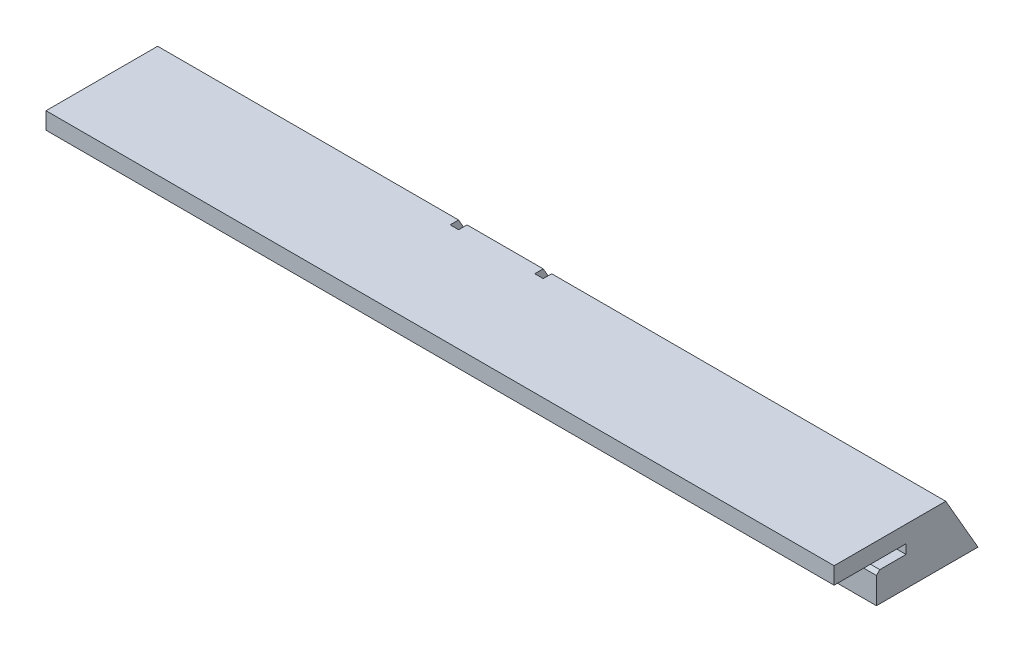
from build123d import *

# Parameters (mm, degrees)
SKETCH_2_W                  = 93.1
SKETCH_2_H                  = 10
EXTRUDE_1_DEPTH             = 3.5
SKETCH_4_W                  = 93.1
SKETCH_4_H                  = 6.5
EXTRUDE_2_DEPTH             = 1.1
SKETCH_5_W                  = 93.1
SKETCH_5_H                  = 10
EXTRUDE_3_DEPTH             = 2
CUT_EXTRUDE_1_DEPTH         = 94.867832616
SKETCH_7_W                  = 83.1
SKETCH_7_H                  = 1.1
EXTRUDE_4_DEPTH             = 3.5
CHAMFER_1_SIZE              = 0.4
CUT_EXTRUDE_2_REACH         = 95.868
SKETCH_8_R                  = 150
SKETCH_9_W                  = 93.1
SKETCH_9_H                  = 2
EXTRUDE_5_DEPTH             = 5
EXTRUDE_5_DIRECTION_2_REACH = 95.868
SKETCH_10_W                 = 93.1
SKETCH_10_H                 = 7.621023553
EXTRUDE_6_DEPTH             = 2
SKETCH_11_W                 = 1
SKETCH_11_H                 = 7.621023553
CUT_EXTRUDE_3_DEPTH         = 1


with BuildPart() as part:
    # 草图2 → 凸台-拉伸1 (new body)
    with BuildSketch(Plane(origin=(0, 0, 0), x_dir=(1, 0, 0), z_dir=(0, 1, 0))):
        with Locations((46.55, 5)):
            Rectangle(SKETCH_2_W, SKETCH_2_H)
    extrude(amount=EXTRUDE_1_DEPTH)

    # 草图4 → 凸台-拉伸2 (add)
    with BuildSketch(Plane(origin=(0, 3.5, 0), x_dir=(1, 0, 0), z_dir=(0, 1, 0))):
        with Locations((46.55, 6.75)):
            Rectangle(SKETCH_4_W, SKETCH_4_H)
    extrude(amount=EXTRUDE_2_DEPTH)

    # 草图5 → 凸台-拉伸3 (add)
    with BuildSketch(Plane(origin=(0, 4.6, 0), x_dir=(1, 0, 0), z_dir=(0, 1, 0))):
        with Locations((46.55, 5)):
            Rectangle(SKETCH_5_W, SKETCH_5_H)
    extrude(amount=EXTRUDE_3_DEPTH)

    # 草图6 → 切除-拉伸1 (cut, through all)
    with BuildSketch(Plane.ZY):
        Polygon((-10, 0), (-6.189488223, 6.6), (-10, 6.6), align=None)
    extrude(amount=-CUT_EXTRUDE_1_DEPTH, mode=Mode.SUBTRACT)

    # 草图7 → 凸台-拉伸4 (add)
    with BuildSketch(Plane.XY.offset(-3.5)):
        with Locations((46.55, 4.05)):
            Rectangle(SKETCH_7_W, SKETCH_7_H)
    extrude(amount=EXTRUDE_4_DEPTH)

    # 倒角1
    chamfer_1_edges = [part.edges().sort_by_distance(p)[0] for p in [
        (90.6, 3.5, 0),
        (2.5, 3.5, 0),
    ]]
    chamfer(chamfer_1_edges, length=CHAMFER_1_SIZE)

    # 草图8 → 切除-拉伸2 (cut, up to next)
    with BuildSketch(Plane.XZ, mode=Mode.PRIVATE) as cut_extrude_2_sk1:
        with Locations((46.55, 147)):
            Circle(SKETCH_8_R)
    cut_extrude_2_tool1 = extrude(cut_extrude_2_sk1.sketch, amount=-CUT_EXTRUDE_2_REACH, mode=Mode.PRIVATE) & part.part
    add(cut_extrude_2_tool1.solids().sort_by_distance((46.55, 0, 147))[0], mode=Mode.SUBTRACT)

    # 草图9 → 凸台-拉伸5 (add)
    with BuildSketch(Plane.XY):
        with Locations((46.55, 5.6)):
            Rectangle(SKETCH_9_W, SKETCH_9_H)
    extrude(amount=EXTRUDE_5_DEPTH)

    # 草图9 → 凸台-拉伸5 direction 2 (add, up to next)
    with BuildSketch(Plane.XY, mode=Mode.PRIVATE) as extrude_5_direction_2_sk1:
        with Locations((46.55, 5.6)):
            Rectangle(SKETCH_9_W, SKETCH_9_H)
    extrude_5_direction_2_tool1 = extrude(extrude_5_direction_2_sk1.sketch, amount=-EXTRUDE_5_DIRECTION_2_REACH, mode=Mode.PRIVATE) - part.part
    add(extrude_5_direction_2_tool1.solids().sort_by_distance((46.55, 5.6, 0))[0])

    # 草图10 → 凸台-拉伸6 (add, along a direction that is not the sketch's normal)
    with BuildSketch(Plane(origin=(0, 4.330127019, -7.5), x_dir=(-1, 0, 0), z_dir=(0, 0.4999999999999947, -0.8660254037844417))):
        with Locations((-46.55, -1.189488223)):
            Rectangle(SKETCH_10_W, SKETCH_10_H)
    extrude(amount=EXTRUDE_6_DEPTH, dir=(0, 0, -1))

    # 草图11 → 切除-拉伸3 (cut, along a direction that is not the sketch's normal)
    with BuildSketch(Plane(origin=(0, 5.196152423, -9), x_dir=(-1, 0, 0), z_dir=(0, 0.49999999999999484, -0.8660254037844418))):
        with Locations((-46.05, -2.189488223)):
            Rectangle(SKETCH_11_W, SKETCH_11_H)
        with Locations((-36.05, -2.189488223)):
            Rectangle(SKETCH_11_W, SKETCH_11_H)
    extrude(amount=-CUT_EXTRUDE_3_DEPTH, dir=(0, 0, -1), mode=Mode.SUBTRACT)


solid = part.part
